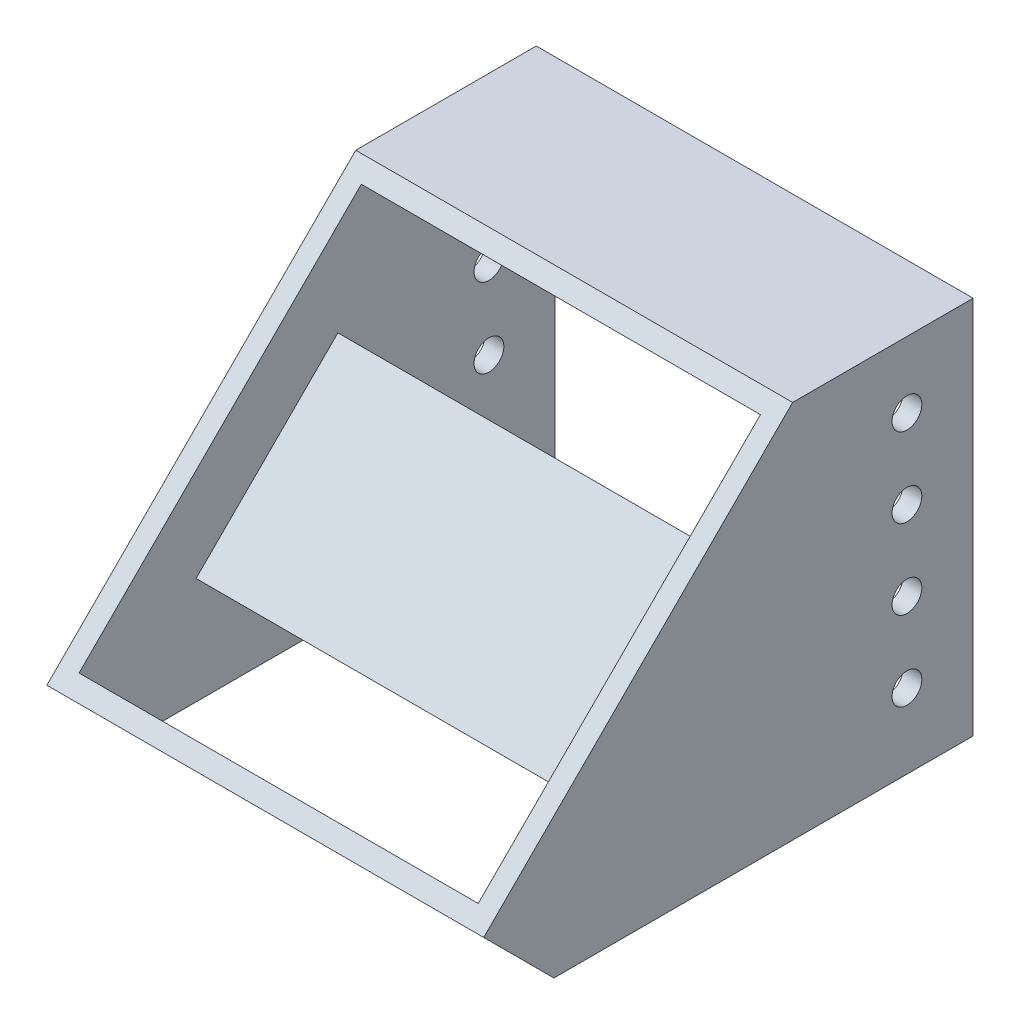
from build123d import *

# Parameters (mm, degrees)
SKETCH1_W               = 66
SKETCH1_H               = 66
BOSS_EXTRUDE1_DEPTH     = 5
SKETCH2_W               = 66
SKETCH2_H               = 66
SKETCH2_W_2             = 60.3
SKETCH2_H_2             = 60.3
BOSS_EXTRUDE2_DEPTH     = 10
CUT_EXTRUDE1_DEPTH      = 55.203320931
CUT_EXTRUDE1_DEPTH_BACK = 55.203320931
SKETCH3_W               = 60.3
SKETCH3_H               = 15
BOSS_EXTRUDE3_REACH     = 100.249
BOSS_EXTRUDE3_START     = -40
SKETCH5_W               = 2.85
SKETCH5_H               = 57.275649276
BOSS_EXTRUDE4_START     = -40
BOSS_EXTRUDE4_DEPTH     = 27.272078
CUT_EXTRUDE2_DEPTH      = 88.796868052
CUT_EXTRUDE2_DEPTH_BACK = 88.796868052
CUT_EXTRUDE3_DEPTH      = 85.308955633
CUT_EXTRUDE3_DEPTH_BACK = 85.308955633
SKETCH12_R              = 2.25


with BuildPart() as part:
    # Sketch1 → Boss-Extrude1 (new body)
    with BuildSketch(Plane(origin=(0, 0, 0), x_dir=(1, 0, 0), z_dir=(0, 0.7071067811865475, 0.7071067811865477))):
        Rectangle(SKETCH1_W, SKETCH1_H)
    extrude(amount=BOSS_EXTRUDE1_DEPTH)

    # Sketch2 → Boss-Extrude2 (add)
    with BuildSketch(Plane(origin=(0, 3.535533906, 3.535533906), x_dir=(1, 0, 0), z_dir=(0, 0.7071067811865476, 0.7071067811865476))):
        Rectangle(SKETCH2_W, SKETCH2_H)
        Rectangle(SKETCH2_W_2, SKETCH2_H_2, mode=Mode.SUBTRACT)
    extrude(amount=BOSS_EXTRUDE2_DEPTH)

    # Sketch3 → Cut-Extrude1 (cut, two sides: drawn at the far end of the back side and taken through both)
    with BuildSketch(Plane(origin=(0, 3.535533906, 3.535533906), x_dir=(1, 0, 0), z_dir=(0, 0.7071067811865476, 0.7071067811865476)).offset(-CUT_EXTRUDE1_DEPTH_BACK)):
        with Locations((0, -22.65)):
            Rectangle(SKETCH3_W, SKETCH3_H)
        with Locations((0, 22.65)):
            Rectangle(SKETCH3_W, SKETCH3_H)
    extrude(amount=CUT_EXTRUDE1_DEPTH + CUT_EXTRUDE1_DEPTH_BACK, mode=Mode.SUBTRACT)

    # Boss-Extrude3: up to this plane
    boss_extrude3_end = Plane(origin=(0, 0, 0), z_dir=(0, -0.7071067811865475, -0.7071067811865477))
    # Sketch5 → Boss-Extrude3 (add, up to the surface)
    with BuildSketch(Plane.XY.offset(BOSS_EXTRUDE3_START), mode=Mode.PRIVATE) as boss_extrude3_sk1:
        with Locations((-31.575, 5.303300859)):
            Rectangle(SKETCH5_W, SKETCH5_H)
    boss_extrude3_tool1 = split(extrude(boss_extrude3_sk1.sketch, amount=BOSS_EXTRUDE3_REACH, mode=Mode.PRIVATE), bisect_by=boss_extrude3_end, keep=Keep.BOTH, mode=Mode.PRIVATE)
    add(boss_extrude3_tool1.solids().sort_by_distance((-31.575, 5.303301, -40))[0])
    # Sketch5 → Boss-Extrude3 (add, up to the surface)
    with BuildSketch(Plane.XY.offset(BOSS_EXTRUDE3_START), mode=Mode.PRIVATE) as boss_extrude3_sk2:
        with Locations((31.575, 5.303300859)):
            Rectangle(SKETCH5_W, SKETCH5_H)
    boss_extrude3_tool2 = split(extrude(boss_extrude3_sk2.sketch, amount=BOSS_EXTRUDE3_REACH, mode=Mode.PRIVATE), bisect_by=boss_extrude3_end, keep=Keep.BOTH, mode=Mode.PRIVATE)
    add(boss_extrude3_tool2.solids().sort_by_distance((31.575, 5.303301, -40))[0])

    # Sketch8 → Boss-Extrude4 (add)
    with BuildSketch(Plane.XY.offset(BOSS_EXTRUDE4_START)):
        Polygon((-33, 33.941125497), (-33, 23.334523779), (-30.15, 23.334523779), (-30.15, 30.941125497), (30.15, 30.941125497), (30.15, 23.334523779), (33, 23.334523779), (33, 33.941125497), (30.15, 33.941125497), (-30.15, 33.941125497), align=None)
    extrude(amount=BOSS_EXTRUDE4_DEPTH)

    # Sketch9 → Cut-Extrude2 (cut, two sides: drawn at the far end of the back side and taken through both)
    with BuildSketch(Plane(origin=(0, 0, -40), x_dir=(-1, 0, 0), z_dir=(0, 0, -1)).offset(-CUT_EXTRUDE2_DEPTH_BACK)):
        Polygon((30.15, 23.334523779), (30.15, 30.941125497), (-30.15, 30.941125497), (-30.15, 23.334523779), (-30.15, 21.319269453), (30.15, 21.319269453), align=None)
    extrude(amount=CUT_EXTRUDE2_DEPTH + CUT_EXTRUDE2_DEPTH_BACK, mode=Mode.SUBTRACT)

    # Sketch12 → Cut-Extrude3 (cut, two sides: drawn at the far end of the back side and taken through both)
    with BuildSketch(Plane.ZY.offset(33).offset(-CUT_EXTRUDE3_DEPTH_BACK)):
        with Locations((-30, 23.941125497)):
            Circle(SKETCH12_R)
        with Locations((-30, -12.058874503)):
            Circle(SKETCH12_R)
        with Locations((-30, 11.941125497)):
            Circle(SKETCH12_R)
        with Locations((-30, -0.058874503)):
            Circle(SKETCH12_R)
    extrude(amount=CUT_EXTRUDE3_DEPTH + CUT_EXTRUDE3_DEPTH_BACK, mode=Mode.SUBTRACT)


solid = part.part
